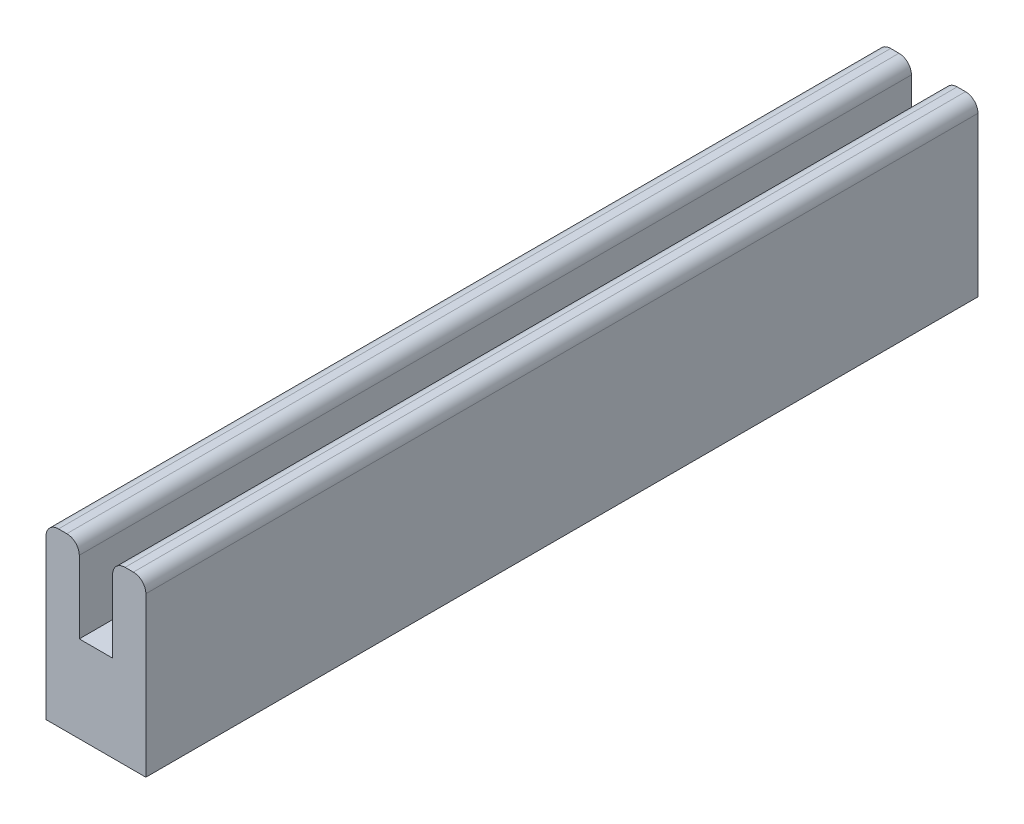
from build123d import *

# Parameters (mm, degrees)
BOSS_EXTRU_1_DEPTH = 50
CONG_1_R           = 0.75
ESQUISSE2_W        = 6
ESQUISSE2_H        = 5.312116381
ESQUISSE2_H_2      = 5.312116382
BOSS_EXTRU_2_DEPTH = 2
CONG_2_R           = 0.5


with BuildPart() as part:
    # Esquisse1 → Boss.-Extru.1 (new body)
    with BuildSketch(Plane.XY):
        Polygon((-4.120689655, 5.1), (-2.120689655, 5.1), (-2.120689655, 0), (-0.120689655, 0), (-0.120689655, 5.1), (1.879310345, 5.1), (1.879310345, -5.2), (-4.120689655, -5.2), align=None)
    extrude(amount=BOSS_EXTRU_1_DEPTH)

    # Congé1
    cong_1_edges = [part.edges().sort_by_distance(p)[0] for p in [
        (-4.120689655, 5.1, 25),
        (-2.120689655, 5.1, 25),
        (-0.120689655, 5.1, 25),
        (1.879310345, 5.1, 25),
    ]]
    fillet(cong_1_edges, radius=CONG_1_R)

    # Esquisse2 → Boss.-Extru.2 (add)
    with BuildSketch(Plane.XZ.offset(5.2)):
        with Locations((-7.120689655, 39.088656491)):
            Rectangle(ESQUISSE2_W, ESQUISSE2_H)
        with Locations((-7.100094061, 14.445055711)):
            Rectangle(ESQUISSE2_W, ESQUISSE2_H_2)
    extrude(amount=-BOSS_EXTRU_2_DEPTH)

    # Congé2
    cong_2_edges = [part.edges().sort_by_distance(p)[0] for p in [
        (-10.120689655, -3.2, 39.088656491),
        (-7.120689655, -3.2, 41.744714681),
        (-7.120689655, -3.2, 36.4325983),
        (-7.110391858, -3.2, 17.101113902),
        (-7.110391858, -3.2, 11.78899752),
        (-10.100094061, -3.2, 14.445055711),
    ]]
    fillet(cong_2_edges, radius=CONG_2_R)


solid = part.part
